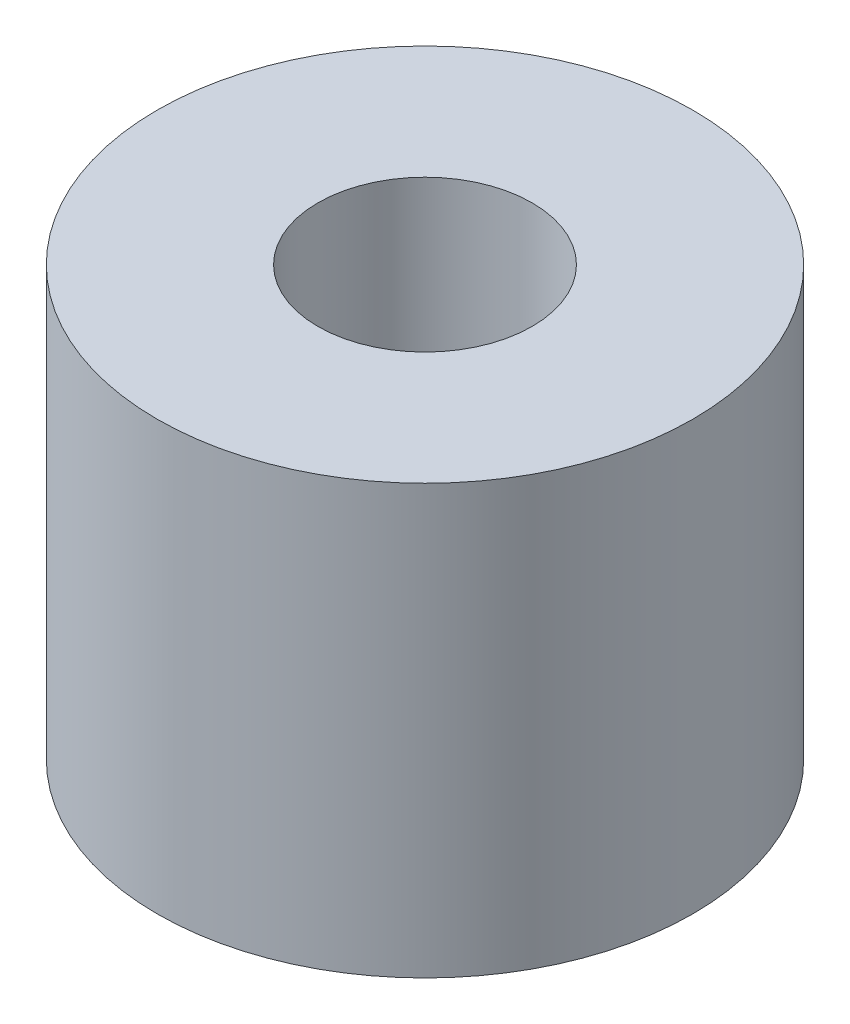
from build123d import *

# Parameters (mm, degrees)
SKETCH_1_R      = 2.5
SKETCH_1_R_2    = 1
EXTRUDE_1_DEPTH = 4


with BuildPart() as part:
    # 草图1 → 凸台-拉伸1 (new body)
    with BuildSketch(Plane(origin=(0, 0, 0), x_dir=(1, 0, 0), z_dir=(0, 1, 0))):
        with Locations(Location((0, 0, 0), (0, 0, 270))):
            Circle(SKETCH_1_R)
        with Locations(Location((0, 0, 0), (0, 0, 270))):
            Circle(SKETCH_1_R_2, mode=Mode.SUBTRACT)
    extrude(amount=EXTRUDE_1_DEPTH)


solid = part.part
